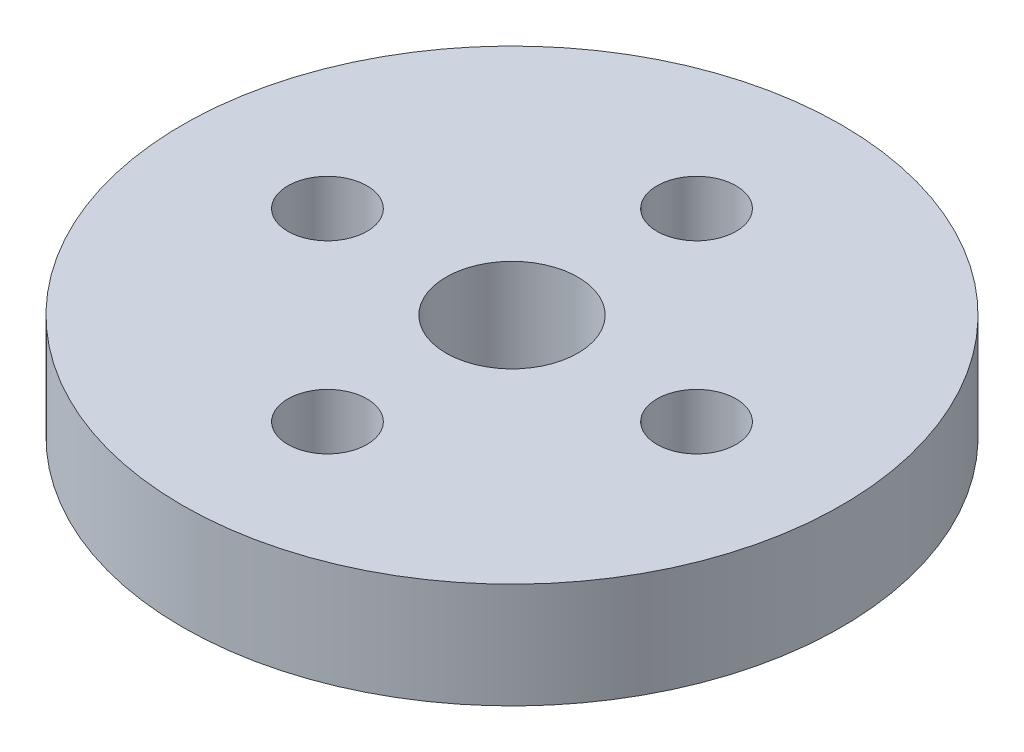
from build123d import *

# Parameters (mm, degrees)
SKETCH_1_R      = 12.5
SKETCH_1_R_2    = 1.5
SKETCH_1_R_3    = 2.5
EXTRUDE_1_DEPTH = 4


with BuildPart() as part:
    # 草图1 → 凸台-拉伸1 (new body)
    with BuildSketch(Plane(origin=(0, 0, 0), x_dir=(1, 0, 0), z_dir=(0, 1, 0))):
        with Locations(Location((0, 0, 0), (0, 0, 270))):
            Circle(SKETCH_1_R)
        with Locations(Location((0, 7, 0), (0, 0, 270))):
            Circle(SKETCH_1_R_2, mode=Mode.SUBTRACT)
        with Locations(Location((7, 0, 0), (0, 0, 270))):
            Circle(SKETCH_1_R_2, mode=Mode.SUBTRACT)
        with Locations(Location((0, -7, 0), (0, 0, 270))):
            Circle(SKETCH_1_R_2, mode=Mode.SUBTRACT)
        with Locations(Location((-7, 0, 0), (0, 0, 270))):
            Circle(SKETCH_1_R_2, mode=Mode.SUBTRACT)
        with Locations(Location((0, 0, 0), (0, 0, 270))):
            Circle(SKETCH_1_R_3, mode=Mode.SUBTRACT)
    extrude(amount=EXTRUDE_1_DEPTH)


solid = part.part
